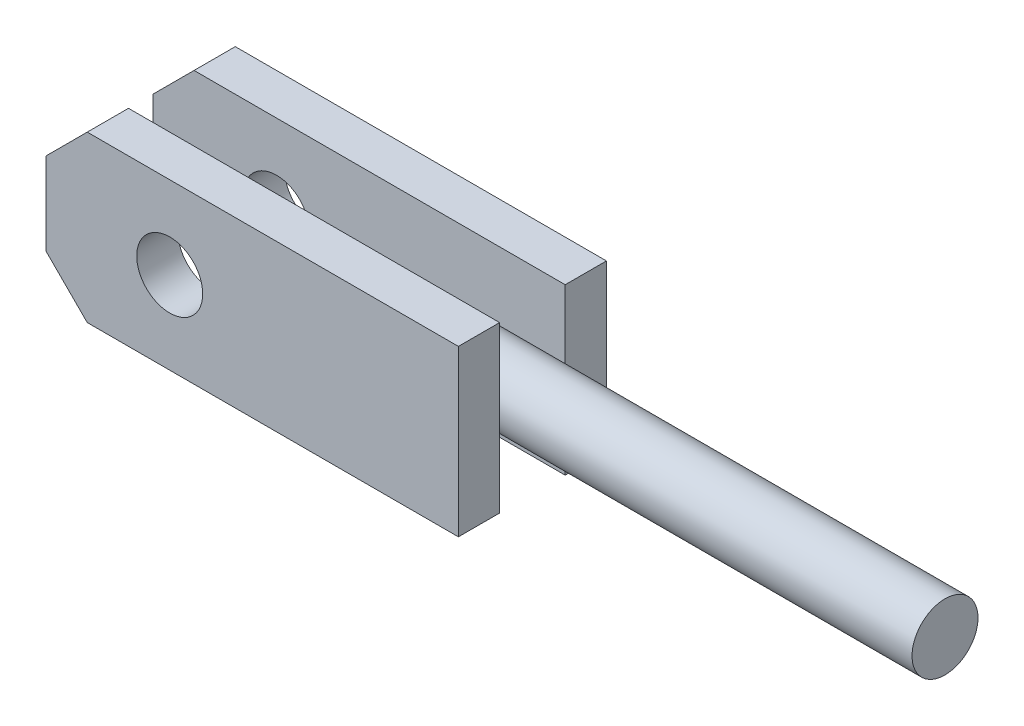
from build123d import *

# Parameters (mm, degrees)
SKETCH1_W                = 100
SKETCH1_H                = 40
BOSS_EXTRUDE1_DEPTH      = 10
SKETCH4_R                = 8
CUT_EXTRUDE1_DEPTH       = 10
CHAMFER2_SIZE            = 10
CHAMFER3_SIZE            = 10
BOSS_EXTRUDE2_DEPTH      = 100
BOSS_EXTRUDE2_DEPTH_BACK = 20
SKETCH5_R                = 8
LPATTERN1_COUNT          = 2
LPATTERN1_PITCH          = 25.9
CHAMFER4_SIZE            = 10
CHAMFER5_SIZE            = 10
CUT_EXTRUDE2_START       = -100
SKETCH6_R                = 8
CUT_EXTRUDE2_DEPTH       = 100


with BuildPart() as part:
    # Sketch1 → Boss-Extrude1 (new body)
    with BuildSketch(Plane.XY):
        Rectangle(SKETCH1_W, SKETCH1_H)
    boss_extrude1 = extrude(amount=BOSS_EXTRUDE1_DEPTH)

    # Sketch4 → Cut-Extrude1 (cut)
    with BuildSketch(Plane.XY.offset(10)):
        with Locations((-20, 0)):
            Circle(SKETCH4_R)
    extrude(amount=-CUT_EXTRUDE1_DEPTH, mode=Mode.SUBTRACT)

    # Chamfer2
    chamfer2_edges = [part.edges().sort_by_distance(p)[0] for p in [
        (-50, 20, 5),
    ]]
    chamfer(chamfer2_edges, length=CHAMFER2_SIZE)

    # Chamfer3
    chamfer3_edges = [part.edges().sort_by_distance(p)[0] for p in [
        (-50, -20, 5),
    ]]
    chamfer(chamfer3_edges, length=CHAMFER3_SIZE)


with BuildPart() as body_2:
    # Sketch5 → Boss-Extrude2 (new, two sides: drawn at the far end of the back side and taken through both)
    with BuildSketch(Plane(origin=(50, 0, 0), x_dir=(0, 0, -1), z_dir=(1, 0, 0)).offset(-BOSS_EXTRUDE2_DEPTH_BACK)):
        with Locations((8, 0)):
            Circle(SKETCH5_R)
    extrude(amount=BOSS_EXTRUDE2_DEPTH + BOSS_EXTRUDE2_DEPTH_BACK)

    # LPattern1: Boss-Extrude1 ×2
    with Locations(*[(0, 0, -i * LPATTERN1_PITCH) for i in range(1, LPATTERN1_COUNT)]):
        add(boss_extrude1)

    # Chamfer4
    chamfer4_edges = [body_2.edges().sort_by_distance(p)[0] for p in [
        (-50, 20, -20.9),
    ]]
    chamfer(chamfer4_edges, length=CHAMFER4_SIZE)

    # Chamfer5
    chamfer5_edges = [body_2.edges().sort_by_distance(p)[0] for p in [
        (-50, -20, -20.9),
    ]]
    chamfer(chamfer5_edges, length=CHAMFER5_SIZE)

    # Sketch6 → Cut-Extrude2 (cut)
    with BuildSketch(Plane(origin=(0, 0, -25.9), x_dir=(-1, 0, 0), z_dir=(0, 0, -1)).offset(CUT_EXTRUDE2_START)):
        with Locations((20, 0)):
            Circle(SKETCH6_R)
    extrude(amount=CUT_EXTRUDE2_DEPTH, mode=Mode.SUBTRACT)


solid = Compound([part.part, body_2.part])
